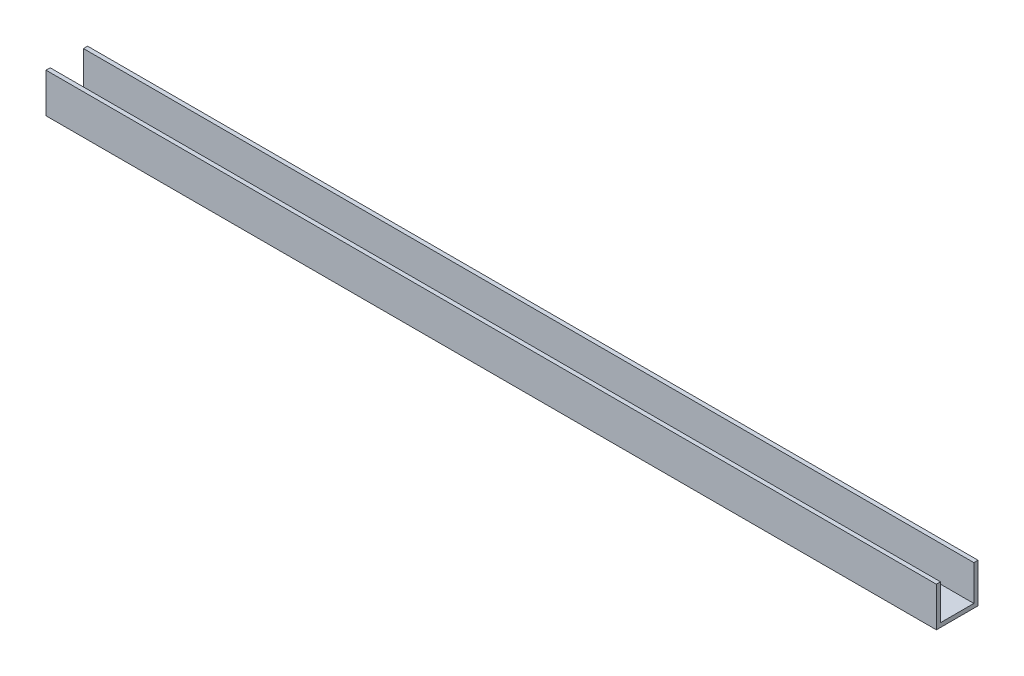
from build123d import *

# Parameters (mm, degrees)
BOSS_EXTRU_1_DEPTH      = 107
ESQUISSE2_R             = 2.5
ENL_V_MAT_EXTRU_1_DEPTH = 108.537202865


with BuildPart() as part:
    # Esquisse1 → Boss.-Extru.1 (new, symmetric)
    with BuildSketch(Plane(origin=(0, 0, 0), x_dir=(0, 0, -1), z_dir=(1, 0, 0))):
        Polygon((-5, 9.5), (-4, 9.5), (-4, 1), (4, 1), (4, 9.5), (5, 9.5), (5, 0), (-5, 0), align=None)
    extrude(amount=BOSS_EXTRU_1_DEPTH, both=True)

    # Esquisse2 → Enlèv. mat.-Extru.1 (cut, through all)
    with BuildSketch(Plane.XZ):
        with Locations(Location((-88, 0, 0), (0, 0, 270))):
            Circle(ESQUISSE2_R)
        with Locations(Location((-79, 0, 0), (0, 0, 270))):
            Circle(ESQUISSE2_R)
        with Locations(Location((-70, 0, 0), (0, 0, 270))):
            Circle(ESQUISSE2_R)
        with Locations(Location((-56, 0, 0), (0, 0, 270))):
            Circle(ESQUISSE2_R)
        with Locations(Location((-47, 0, 0), (0, 0, 270))):
            Circle(ESQUISSE2_R)
        with Locations(Location((-38, 0, 0), (0, 0, 270))):
            Circle(ESQUISSE2_R)
        with Locations(Location((-24, 0, 0), (0, 0, 270))):
            Circle(ESQUISSE2_R)
        with Locations(Location((-15, 0, 0), (0, 0, 270))):
            Circle(ESQUISSE2_R)
        with Locations(Location((-6, 0, 0), (0, 0, 270))):
            Circle(ESQUISSE2_R)
        with Locations(Location((8, 0, 0), (0, 0, 270))):
            Circle(ESQUISSE2_R)
        with Locations(Location((17, 0, 0), (0, 0, 270))):
            Circle(ESQUISSE2_R)
        with Locations(Location((26, 0, 0), (0, 0, 270))):
            Circle(ESQUISSE2_R)
        with Locations(Location((40, 0, 0), (0, 0, 270))):
            Circle(ESQUISSE2_R)
        with Locations(Location((49, 0, 0), (0, 0, 270))):
            Circle(ESQUISSE2_R)
        with Locations(Location((58, 0, 0), (0, 0, 270))):
            Circle(ESQUISSE2_R)
        with Locations(Location((72, 0, 0), (0, 0, 270))):
            Circle(ESQUISSE2_R)
        with Locations(Location((81, 0, 0), (0, 0, 270))):
            Circle(ESQUISSE2_R)
        with Locations(Location((90, 0, 0), (0, 0, 270))):
            Circle(ESQUISSE2_R)
    extrude(amount=-ENL_V_MAT_EXTRU_1_DEPTH, mode=Mode.SUBTRACT)


solid = part.part
